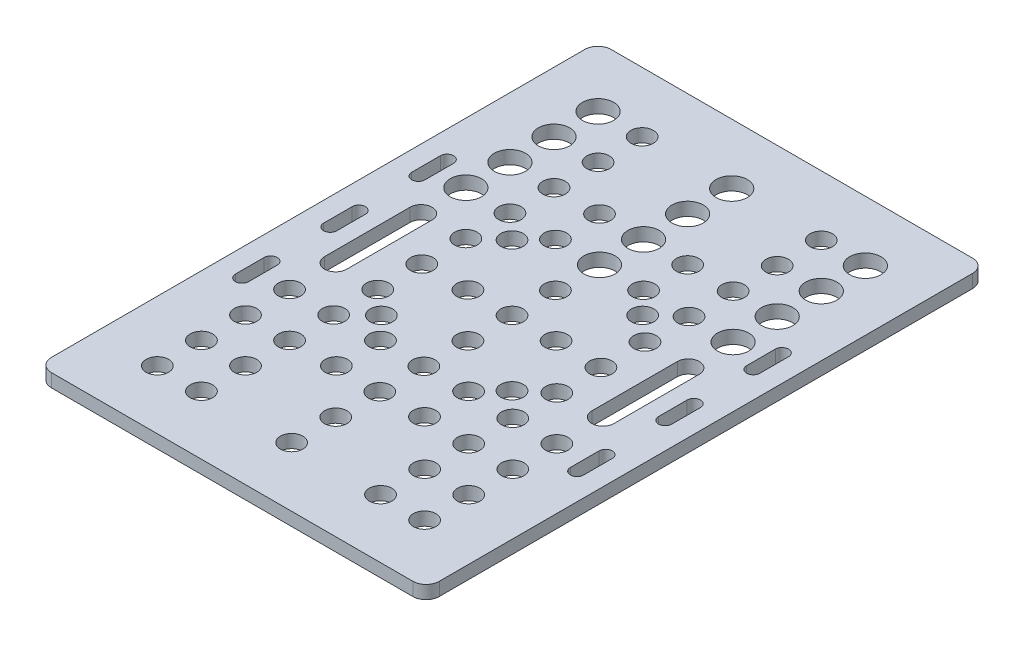
from build123d import *

# Parameters (mm, degrees)
SKETCH_1_W      = 88
SKETCH_1_H      = 127
SKETCH_1_R      = 3.55
SKETCH_1_R_2    = 2.55
EXTRUDE_1_DEPTH = 3
FILLET_1_R      = 3


with BuildPart() as part:
    # 草图1 → 凸台-拉伸1 (new body)
    with BuildSketch(Plane(origin=(0, 0, 0), x_dir=(1, 0, 0), z_dir=(0, 1, 0))):
        with Locations((44, -63.5)):
            Rectangle(SKETCH_1_W, SKETCH_1_H)
        with Locations(Location((13.68, -13.65, 0), (0, 0, 270))):
            Circle(SKETCH_1_R, mode=Mode.SUBTRACT)
        with Locations(Location((44, -13.65, 0), (0, 0, 270))):
            Circle(SKETCH_1_R, mode=Mode.SUBTRACT)
        with Locations(Location((74.32, -13.65, 0), (0, 0, 270))):
            Circle(SKETCH_1_R, mode=Mode.SUBTRACT)
        with Locations(Location((44, -23.65, 0), (0, 0, 270))):
            Circle(SKETCH_1_R, mode=Mode.SUBTRACT)
        with Locations(Location((74.32, -23.65, 0), (0, 0, 270))):
            Circle(SKETCH_1_R, mode=Mode.SUBTRACT)
        with Locations(Location((44, -33.65, 0), (0, 0, 270))):
            Circle(SKETCH_1_R, mode=Mode.SUBTRACT)
        with Locations(Location((74.32, -33.65, 0), (0, 0, 270))):
            Circle(SKETCH_1_R, mode=Mode.SUBTRACT)
        with Locations(Location((44, -43.65, 0), (0, 0, 270))):
            Circle(SKETCH_1_R, mode=Mode.SUBTRACT)
        with Locations(Location((74.32, -43.65, 0), (0, 0, 270))):
            Circle(SKETCH_1_R, mode=Mode.SUBTRACT)
        with Locations(Location((13.68, -23.65, 0), (0, 0, 270))):
            Circle(SKETCH_1_R, mode=Mode.SUBTRACT)
        with Locations(Location((13.68, -33.65, 0), (0, 0, 270))):
            Circle(SKETCH_1_R, mode=Mode.SUBTRACT)
        with Locations(Location((13.68, -43.65, 0), (0, 0, 270))):
            Circle(SKETCH_1_R, mode=Mode.SUBTRACT)
        with Locations(Location((23.68, -13.65, 0), (0, 0, 270))):
            Circle(SKETCH_1_R_2, mode=Mode.SUBTRACT)
        with Locations(Location((64.32, -13.65, 0), (0, 0, 90))):
            Circle(SKETCH_1_R_2, mode=Mode.SUBTRACT)
        with Locations(Location((23.68, -23.65, 0), (0, 0, 270))):
            Circle(SKETCH_1_R_2, mode=Mode.SUBTRACT)
        with Locations(Location((64.32, -23.65, 0), (0, 0, 90))):
            Circle(SKETCH_1_R_2, mode=Mode.SUBTRACT)
        with Locations(Location((23.68, -33.65, 0), (0, 0, 270))):
            Circle(SKETCH_1_R_2, mode=Mode.SUBTRACT)
        with Locations(Location((64.32, -33.65, 0), (0, 0, 90))):
            Circle(SKETCH_1_R_2, mode=Mode.SUBTRACT)
        with Locations(Location((23.68, -43.65, 0), (0, 0, 270))):
            Circle(SKETCH_1_R_2, mode=Mode.SUBTRACT)
        with Locations(Location((64.32, -43.65, 0), (0, 0, 90))):
            Circle(SKETCH_1_R_2, mode=Mode.SUBTRACT)
        with Locations(Location((23.68, -53.65, 0), (0, 0, 270))):
            Circle(SKETCH_1_R_2, mode=Mode.SUBTRACT)
        with Locations(Location((64.32, -53.65, 0), (0, 0, 90))):
            Circle(SKETCH_1_R_2, mode=Mode.SUBTRACT)
        with Locations(Location((23.68, -63.65, 0), (0, 0, 270))):
            Circle(SKETCH_1_R_2, mode=Mode.SUBTRACT)
        with Locations(Location((64.32, -63.65, 0), (0, 0, 90))):
            Circle(SKETCH_1_R_2, mode=Mode.SUBTRACT)
        with Locations(Location((23.68, -73.65, 0), (0, 0, 270))):
            Circle(SKETCH_1_R_2, mode=Mode.SUBTRACT)
        with Locations(Location((64.32, -73.65, 0), (0, 0, 90))):
            Circle(SKETCH_1_R_2, mode=Mode.SUBTRACT)
        with Locations(Location((23.68, -83.65, 0), (0, 0, 270))):
            Circle(SKETCH_1_R_2, mode=Mode.SUBTRACT)
        with Locations(Location((64.32, -83.65, 0), (0, 0, 90))):
            Circle(SKETCH_1_R_2, mode=Mode.SUBTRACT)
        with Locations(Location((23.68, -93.65, 0), (0, 0, 270))):
            Circle(SKETCH_1_R_2, mode=Mode.SUBTRACT)
        with Locations(Location((64.32, -93.65, 0), (0, 0, 90))):
            Circle(SKETCH_1_R_2, mode=Mode.SUBTRACT)
        with Locations(Location((23.68, -103.65, 0), (0, 0, 270))):
            Circle(SKETCH_1_R_2, mode=Mode.SUBTRACT)
        with Locations(Location((64.32, -103.65, 0), (0, 0, 90))):
            Circle(SKETCH_1_R_2, mode=Mode.SUBTRACT)
        with Locations(Location((23.68, -113.65, 0), (0, 0, 270))):
            Circle(SKETCH_1_R_2, mode=Mode.SUBTRACT)
        with Locations(Location((64.32, -113.65, 0), (0, 0, 90))):
            Circle(SKETCH_1_R_2, mode=Mode.SUBTRACT)
        with Locations(Location((29.18, -48.68, 0), (0, 0, 270))):
            Circle(SKETCH_1_R_2, mode=Mode.SUBTRACT)
        with Locations(Location((29.18, -78.32, 0), (0, 0, 90))):
            Circle(SKETCH_1_R_2, mode=Mode.SUBTRACT)
        with Locations(Location((58.82, -48.68, 0), (0, 0, 90))):
            Circle(SKETCH_1_R_2, mode=Mode.SUBTRACT)
        with Locations(Location((58.82, -78.32, 0), (0, 0, 270))):
            Circle(SKETCH_1_R_2, mode=Mode.SUBTRACT)
        with Locations(Location((34, -63.5, 0), (0, 0, 270))):
            Circle(SKETCH_1_R_2, mode=Mode.SUBTRACT)
        with Locations(Location((54, -63.5, 0), (0, 0, 90))):
            Circle(SKETCH_1_R_2, mode=Mode.SUBTRACT)
        with Locations(Location((44, -63.5, 0), (0, 0, 270))):
            Circle(SKETCH_1_R_2, mode=Mode.SUBTRACT)
        with Locations(Location((34, -33.65, 0), (0, 0, 270))):
            Circle(SKETCH_1_R_2, mode=Mode.SUBTRACT)
        with Locations(Location((34, -43.65, 0), (0, 0, 270))):
            Circle(SKETCH_1_R_2, mode=Mode.SUBTRACT)
        with Locations(Location((54, -43.65, 0), (0, 0, 90))):
            Circle(SKETCH_1_R_2, mode=Mode.SUBTRACT)
        with Locations(Location((54, -33.65, 0), (0, 0, 90))):
            Circle(SKETCH_1_R_2, mode=Mode.SUBTRACT)
        with Locations(Location((54, -93.35, 0), (0, 0, 270))):
            Circle(SKETCH_1_R_2, mode=Mode.SUBTRACT)
        with Locations(Location((54, -83.35, 0), (0, 0, 270))):
            Circle(SKETCH_1_R_2, mode=Mode.SUBTRACT)
        with Locations(Location((34, -83.35, 0), (0, 0, 90))):
            Circle(SKETCH_1_R_2, mode=Mode.SUBTRACT)
        with Locations(Location((34, -93.35, 0), (0, 0, 90))):
            Circle(SKETCH_1_R_2, mode=Mode.SUBTRACT)
        with Locations(Location((44, -53.65, 0), (0, 0, 270))):
            Circle(SKETCH_1_R_2, mode=Mode.SUBTRACT)
        with Locations(Location((44, -73.5, 0), (0, 0, 270))):
            Circle(SKETCH_1_R_2, mode=Mode.SUBTRACT)
        with Locations(Location((44, -83.5, 0), (0, 0, 270))):
            Circle(SKETCH_1_R_2, mode=Mode.SUBTRACT)
        with Locations(Location((44, -93.5, 0), (0, 0, 270))):
            Circle(SKETCH_1_R_2, mode=Mode.SUBTRACT)
        with Locations(Location((44, -103.5, 0), (0, 0, 270))):
            Circle(SKETCH_1_R_2, mode=Mode.SUBTRACT)
        with Locations(Location((44, -113.5, 0), (0, 0, 270))):
            Circle(SKETCH_1_R_2, mode=Mode.SUBTRACT)
        with Locations(Location((13.68, -83.65, 0), (0, 0, 270))):
            Circle(SKETCH_1_R_2, mode=Mode.SUBTRACT)
        with Locations(Location((74.32, -83.65, 0), (0, 0, 90))):
            Circle(SKETCH_1_R_2, mode=Mode.SUBTRACT)
        with Locations(Location((13.68, -93.65, 0), (0, 0, 270))):
            Circle(SKETCH_1_R_2, mode=Mode.SUBTRACT)
        with Locations(Location((74.32, -93.65, 0), (0, 0, 90))):
            Circle(SKETCH_1_R_2, mode=Mode.SUBTRACT)
        with Locations(Location((13.68, -103.65, 0), (0, 0, 270))):
            Circle(SKETCH_1_R_2, mode=Mode.SUBTRACT)
        with Locations(Location((74.32, -103.65, 0), (0, 0, 90))):
            Circle(SKETCH_1_R_2, mode=Mode.SUBTRACT)
        with Locations(Location((13.68, -113.65, 0), (0, 0, 270))):
            Circle(SKETCH_1_R_2, mode=Mode.SUBTRACT)
        with Locations(Location((74.32, -113.65, 0), (0, 0, 90))):
            Circle(SKETCH_1_R_2, mode=Mode.SUBTRACT)
        with BuildLine():
            Line((7.5, -40.25), (7.5, -46.75))
            ThreePointArc((7.5, -46.75), (6, -48.25), (4.5, -46.75))
            Line((4.5, -46.75), (4.5, -40.25))
            ThreePointArc((4.5, -40.25), (6, -38.75), (7.5, -40.25))
        make_face(mode=Mode.SUBTRACT)
        with BuildLine():
            Line((7.5, -60.25), (7.5, -66.75))
            ThreePointArc((7.5, -66.75), (6, -68.25), (4.5, -66.75))
            Line((4.5, -66.75), (4.5, -60.25))
            ThreePointArc((4.5, -60.25), (6, -58.75), (7.5, -60.25))
        make_face(mode=Mode.SUBTRACT)
        with BuildLine():
            Line((7.5, -86.75), (7.5, -80.25))
            ThreePointArc((7.5, -80.25), (6, -78.75), (4.5, -80.25))
            Line((4.5, -80.25), (4.5, -86.75))
            ThreePointArc((4.5, -86.75), (6, -88.25), (7.5, -86.75))
        make_face(mode=Mode.SUBTRACT)
        with BuildLine():
            Line((80.5, -86.75), (80.5, -80.25))
            ThreePointArc((80.5, -80.25), (82, -78.75), (83.5, -80.25))
            Line((83.5, -80.25), (83.5, -86.75))
            ThreePointArc((83.5, -86.75), (82, -88.25), (80.5, -86.75))
        make_face(mode=Mode.SUBTRACT)
        with BuildLine():
            Line((80.5, -60.25), (80.5, -66.75))
            ThreePointArc((80.5, -66.75), (82, -68.25), (83.5, -66.75))
            Line((83.5, -66.75), (83.5, -60.25))
            ThreePointArc((83.5, -60.25), (82, -58.75), (80.5, -60.25))
        make_face(mode=Mode.SUBTRACT)
        with BuildLine():
            Line((80.5, -40.25), (80.5, -46.75))
            ThreePointArc((80.5, -46.75), (82, -48.25), (83.5, -46.75))
            Line((83.5, -46.75), (83.5, -40.25))
            ThreePointArc((83.5, -40.25), (82, -38.75), (80.5, -40.25))
        make_face(mode=Mode.SUBTRACT)
        with BuildLine():
            Line((16.18, -53.81), (16.18, -73.19))
            ThreePointArc((16.18, -73.19), (13.68, -75.69), (11.18, -73.19))
            Line((11.18, -73.19), (11.18, -53.81))
            ThreePointArc((11.18, -53.81), (13.68, -51.31), (16.18, -53.81))
        make_face(mode=Mode.SUBTRACT)
        with BuildLine():
            Line((71.82, -53.81), (71.82, -73.19))
            ThreePointArc((71.82, -73.19), (74.32, -75.69), (76.82, -73.19))
            Line((76.82, -73.19), (76.82, -53.81))
            ThreePointArc((76.82, -53.81), (74.32, -51.31), (71.82, -53.81))
        make_face(mode=Mode.SUBTRACT)
    extrude(amount=EXTRUDE_1_DEPTH)

    # 圆角1
    fillet_1_edges = [part.edges().sort_by_distance(p)[0] for p in [
        (0, 1.5, 0),
        (88, 1.5, 0),
        (88, 1.5, 127),
        (0, 1.5, 127),
    ]]
    fillet(fillet_1_edges, radius=FILLET_1_R)


solid = part.part
